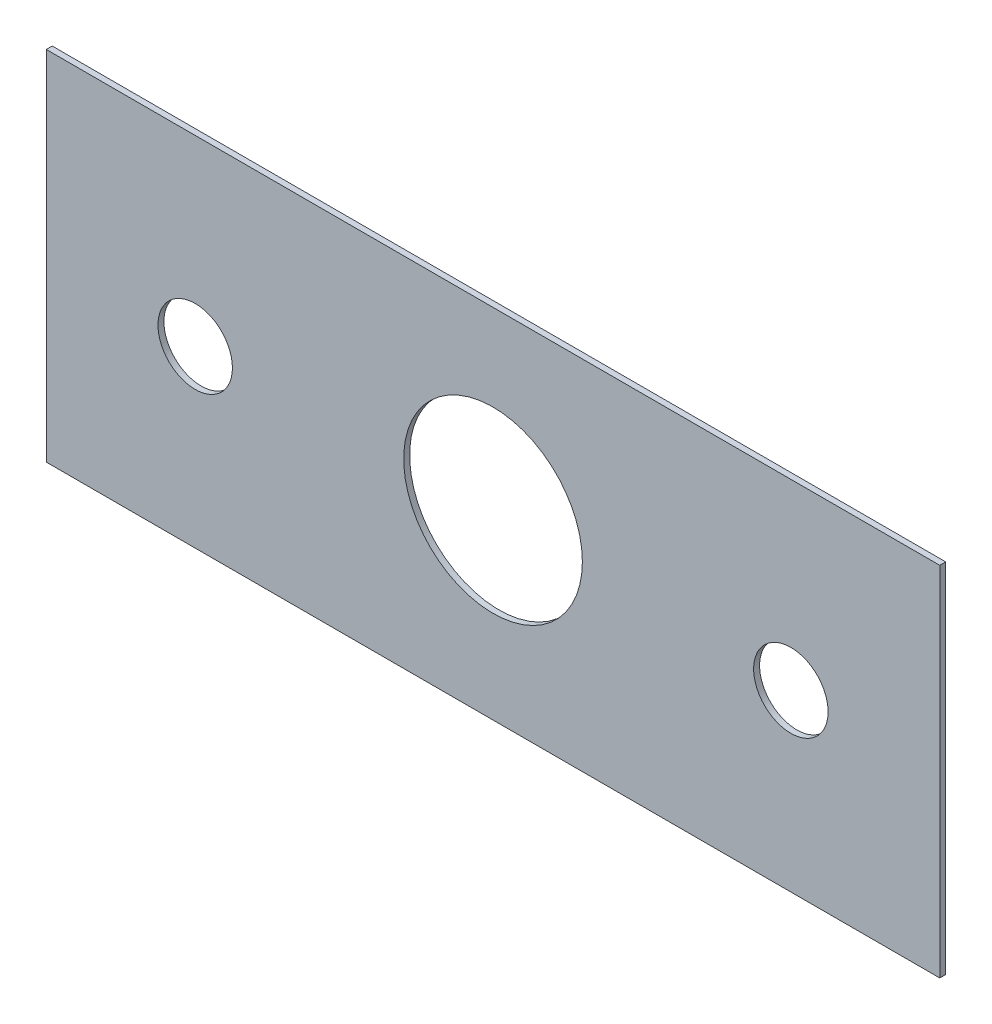
from build123d import *

# Parameters (mm, degrees)
SKETCH1_W           = 150
SKETCH1_H           = 60
BOSS_EXTRUDE1_DEPTH = 1
SKETCH2_R           = 15
SKETCH2_R_2         = 6.25
CUT_EXTRUDE1_DEPTH  = 162.558039107


with BuildPart() as part:
    # Sketch1 → Boss-Extrude1 (new body)
    with BuildSketch(Plane.XY):
        with Locations((-75, 30)):
            Rectangle(SKETCH1_W, SKETCH1_H)
    extrude(amount=BOSS_EXTRUDE1_DEPTH)

    # Sketch2 → Cut-Extrude1 (cut, through all)
    with BuildSketch(Plane.XY.offset(1)):
        with Locations((-75, 30.510920996)):
            Circle(SKETCH2_R)
        with Locations((-125, 29.318772006)):
            Circle(SKETCH2_R_2)
        with Locations((-25, 29.318772006)):
            Circle(SKETCH2_R_2)
    extrude(amount=-CUT_EXTRUDE1_DEPTH, mode=Mode.SUBTRACT)


solid = part.part
